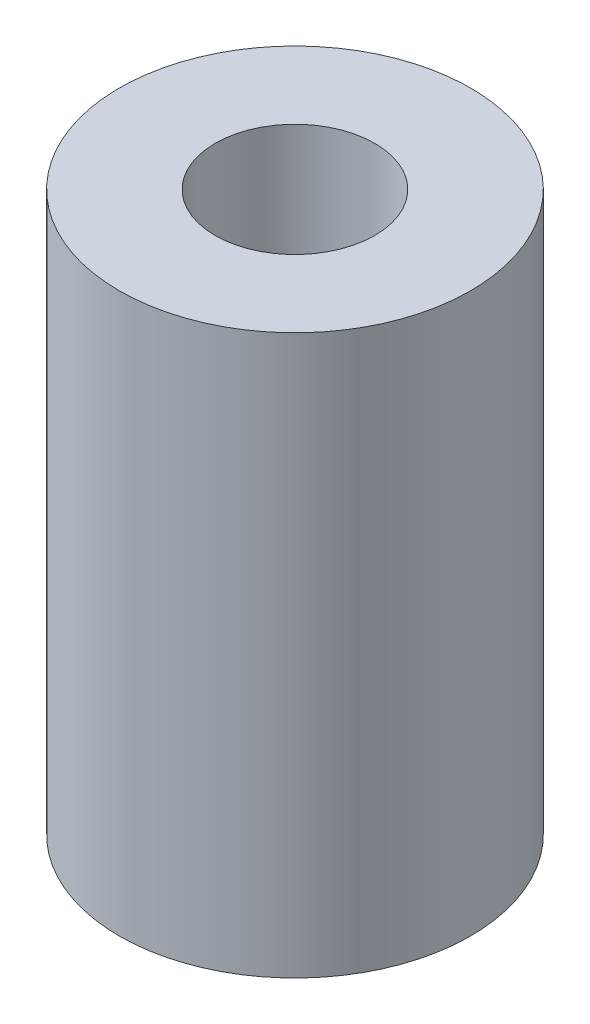
from build123d import *

# Parameters (mm, degrees)
SKETCH1_R           = 5.5
SKETCH1_R_2         = 2.5
BOSS_EXTRUDE1_DEPTH = 17.5


with BuildPart() as part:
    # Sketch1 → Boss-Extrude1 (new body)
    with BuildSketch(Plane(origin=(0, 0, 0), x_dir=(1, 0, 0), z_dir=(0, 1, 0))):
        with Locations(Location((0, 0, 0), (0, 0, 270))):
            Circle(SKETCH1_R)
        with Locations(Location((0, 0, 0), (0, 0, 270))):
            Circle(SKETCH1_R_2, mode=Mode.SUBTRACT)
    extrude(amount=BOSS_EXTRUDE1_DEPTH)


solid = part.part
